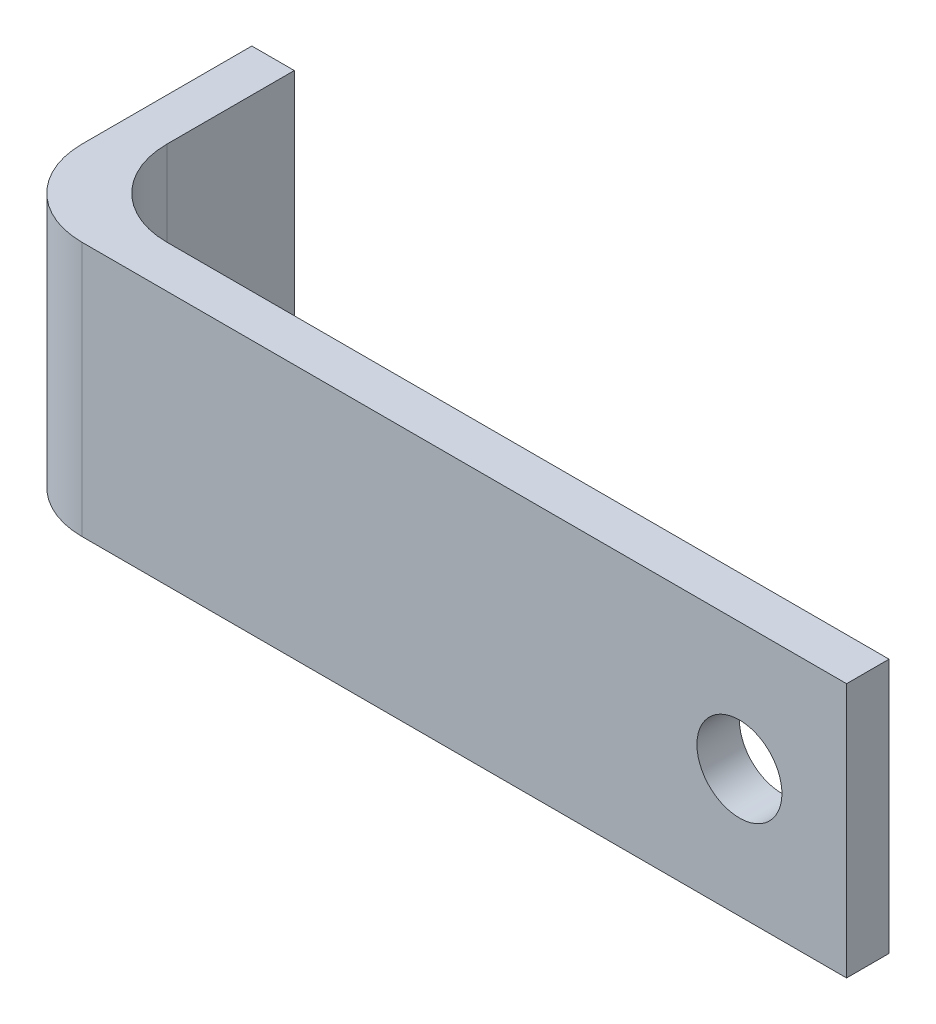
from build123d import *

# Parameters (mm, degrees)
BOSS_EXTRUDE1_DEPTH = 15
SKETCH2_R           = 5
CUT_EXTRUDE1_DEPTH  = 30
SKETCH3_R           = 2.5
BOSS_EXTRUDE2_DEPTH = 1


with BuildPart() as part:
    # Sketch1 → Boss-Extrude1 (new, symmetric)
    with BuildSketch(Plane(origin=(0, 0, 0), x_dir=(1, 0, 0), z_dir=(0, 1, 0))):
        with BuildLine():
            Line((-57.34741784, 10.399061033), (-52.34741784, 10.399061033))
            Line((-52.34741784, 10.399061033), (-52.34741784, -4.600938967))
            ThreePointArc((-52.34741784, -4.600938967), (-49.418485652, -11.672006779), (-42.34741784, -14.600938967))
            Line((-42.34741784, -14.600938967), (42.65258216, -14.600938967))
            Line((42.65258216, -14.600938967), (42.65258216, -19.600938967))
            Line((42.65258216, -19.600938967), (-47.34741784, -19.600938967))
            ThreePointArc((-47.34741784, -19.600938967), (-54.418485652, -16.672006779), (-57.34741784, -9.600938967))
            Line((-57.34741784, -9.600938967), (-57.34741784, 10.399061033))
        make_face()
    extrude(amount=BOSS_EXTRUDE1_DEPTH, both=True)

    # Sketch2 → Cut-Extrude1 (cut)
    with BuildSketch(Plane(origin=(0, 0, 14.600938967), x_dir=(-1, 0, 0), z_dir=(0, 0, -1))):
        with Locations((-30.040799479, 0)):
            Circle(SKETCH2_R)
    extrude(amount=-CUT_EXTRUDE1_DEPTH, mode=Mode.SUBTRACT)

    # Sketch3 → Boss-Extrude2 (add)
    with BuildSketch(Plane.ZY.offset(57.34741784)):
        with Locations(Location((0, 0, 0), (0, 0, 180))):
            Circle(SKETCH3_R)
    extrude(amount=BOSS_EXTRUDE2_DEPTH)


solid = part.part
